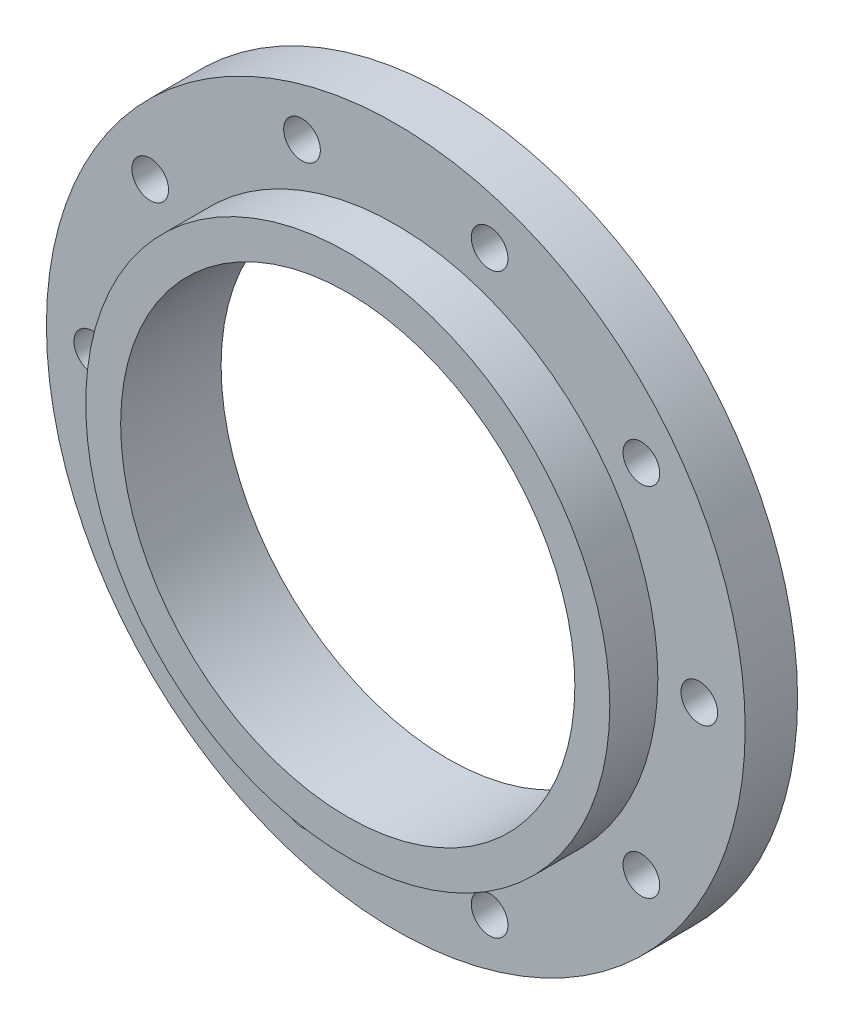
from build123d import *

# Parameters (mm, degrees)
SKETCH1_W                      = 80
SKETCH1_H                      = 12
SKETCH2_R                      = 60
BOSS_EXTRUDE1_DEPTH            = 11
F_8_4_8_4_DIAMETER_HOLE1_D     = 8.4
F_8_4_8_4_DIAMETER_HOLE1_DEPTH = 23
M100_CLEARANCE_HOLE1_D         = 104


with BuildPart() as part:
    # Sketch1 → Revolve1 (revolve)
    with BuildSketch(Plane.XZ, mode=Mode.PRIVATE) as revolve1_sk:
        with Locations((40, -6)):
            Rectangle(SKETCH1_W, SKETCH1_H)
    revolve(revolve1_sk.sketch.rotate(Axis((0, 0, 0), (0, 0, -1)), 180), axis=Axis((0, 0, 0), (0, 0, -1)))

    # Sketch2 → Boss-Extrude1 (add)
    with BuildSketch(Plane.XY):
        Circle(SKETCH2_R)
    extrude(amount=BOSS_EXTRUDE1_DEPTH)

    # Ø8.4 (8.4) Diameter Hole1
    with Locations(Plane(origin=(0, 0, -12), x_dir=(-1, 0, 0), z_dir=(0, 0, -1))):
        with Locations((21.476681109, 66.098427883), (56.226681109, 40.851075034), (69.5, 0), (56.226681109, -40.851075034), (21.476681109, -66.098427883), (-21.476681109, -66.098427883), (-56.226681109, -40.851075034), (-69.5, 0), (-56.226681109, 40.851075034), (-21.476681109, 66.098427883)):
            Hole(F_8_4_8_4_DIAMETER_HOLE1_D / 2, depth=F_8_4_8_4_DIAMETER_HOLE1_DEPTH)

    # M100 Clearance Hole1 (through all)
    with Locations(Plane(origin=(0, 0, -12), x_dir=(-1, 0, 0), z_dir=(0, 0, -1))):
        with Locations((0, 0)):
            Hole(M100_CLEARANCE_HOLE1_D / 2)


solid = part.part
